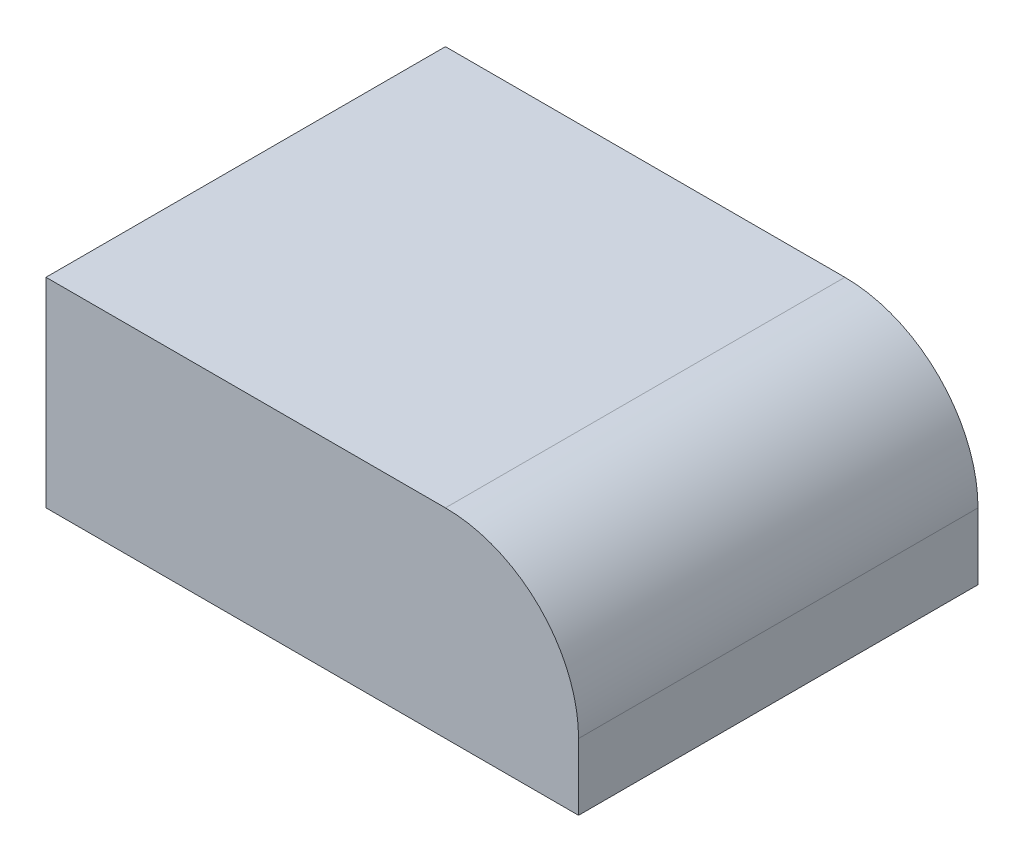
from build123d import *

# Parameters (mm, degrees)
SKETCH1_W           = 50.8
SKETCH1_H           = 19.05
BOSS_EXTRUDE1_DEPTH = 38.1
FILLET1_R           = 12.7


with BuildPart() as part:
    # Sketch1 → Boss-Extrude1 (new body)
    with BuildSketch(Plane.XY):
        with Locations((25.4, 9.525)):
            Rectangle(SKETCH1_W, SKETCH1_H)
    extrude(amount=BOSS_EXTRUDE1_DEPTH)

    # Fillet1
    fillet1_edges = [part.edges().sort_by_distance(p)[0] for p in [
        (50.8, 19.05, 19.05),
    ]]
    fillet(fillet1_edges, radius=FILLET1_R)


solid = part.part
